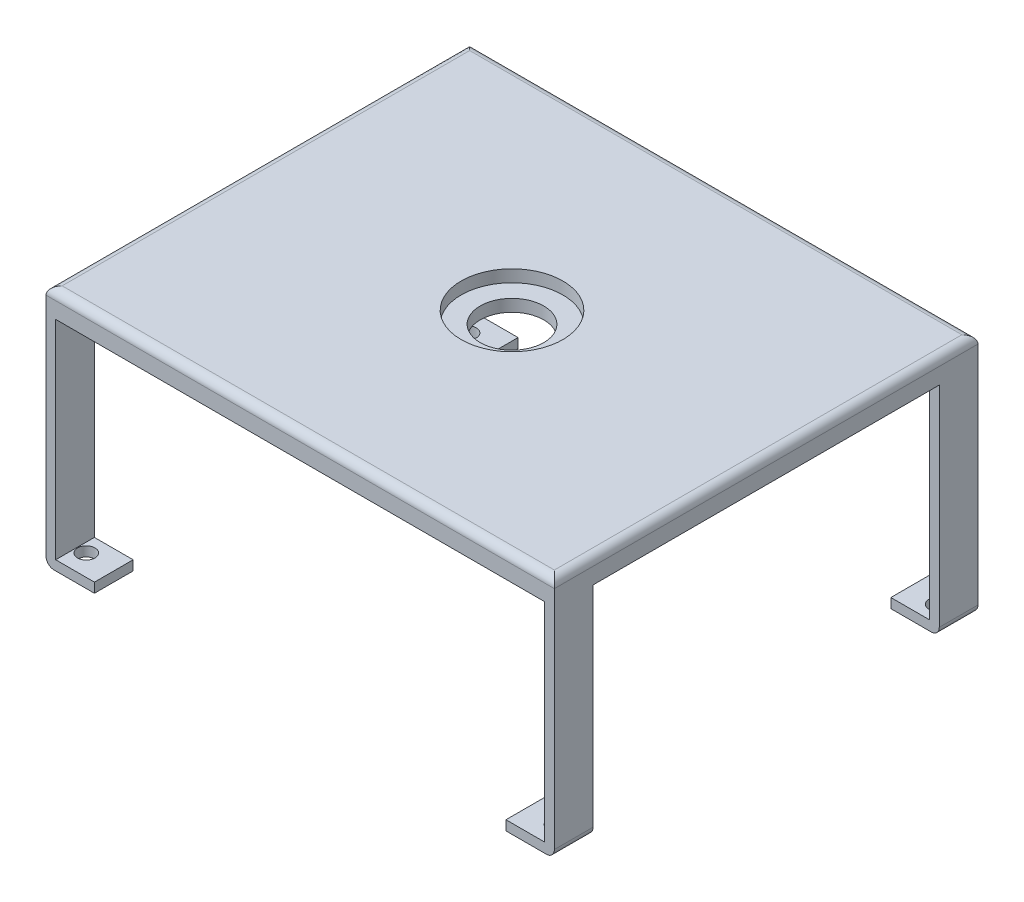
from build123d import *

# Parameters (mm, degrees)
BOSS_EXTRU_1_DEPTH      = 133.35
ESQUISSE3_W             = 108.966
ESQUISSE3_H             = 68.58
ENL_V_MAT_EXTRU_1_DEPTH = 222.799600766
CONG_1_R                = 2.54
CONG_2_R                = 2.54
ESQUISSE6_R             = 10
ENL_V_MAT_EXTRU_4_DEPTH = 174.176969023
ESQUISSE9_R             = 16
ENL_V_MAT_EXTRU_5_DEPTH = 3.81
SKETCH1_R               = 2.75
CUT_EXTRUDE1_DEPTH      = 3.048


with BuildPart() as part:
    # Esquisse2 → Boss.-Extru.1 (new body)
    with BuildSketch(Plane.XY):
        Polygon((-64.77, 0), (-80.01, 0), (-80.01, 76.2), (80.01, 76.2), (80.01, 0), (64.77, 0), (64.77, 3.048), (76.962, 3.048), (76.962, 68.58), (-76.962, 68.58), (-76.962, 3.048), (-64.77, 3.048), align=None)
    extrude(amount=BOSS_EXTRU_1_DEPTH)

    # Esquisse3 → Enlèv. mat.-Extru.1 (cut, through all)
    with BuildSketch(Plane.ZY.offset(80.01)):
        with Locations((66.675, 34.29)):
            Rectangle(ESQUISSE3_W, ESQUISSE3_H)
    extrude(amount=-ENL_V_MAT_EXTRU_1_DEPTH, mode=Mode.SUBTRACT)

    # Congé1
    cong_1_edges = [part.edges().sort_by_distance(p)[0] for p in [
        (-80.01, 0, 127.254),
        (80.01, 0, 127.254),
        (-80.01, 0, 6.096),
        (80.01, 0, 6.096),
    ]]
    fillet(cong_1_edges, radius=CONG_1_R)

    # Congé2
    cong_2_edges = [part.edges().sort_by_distance(p)[0] for p in [
        (0, 76.2, 0),
        (-80.01, 76.2, 66.675),
        (80.01, 76.2, 66.675),
        (0, 76.2, 133.35),
    ]]
    fillet(cong_2_edges, radius=CONG_2_R)

    # Esquisse6 → Enlèv. mat.-Extru.4 (cut, through all)
    with BuildSketch(Plane(origin=(0, 76.2, 0), x_dir=(1, 0, 0), z_dir=(0, 1, 0))):
        with Locations(Location((0, -66.675, 0), (0, 0, 270))):
            Circle(ESQUISSE6_R)
    extrude(amount=-ENL_V_MAT_EXTRU_4_DEPTH, mode=Mode.SUBTRACT)

    # Esquisse9 → Enlèv. mat.-Extru.5 (cut)
    with BuildSketch(Plane(origin=(0, 76.2, 0), x_dir=(1, 0, 0), z_dir=(0, 1, 0))):
        with Locations(Location((0, -66.675, 0), (0, 0, 270))):
            Circle(ESQUISSE9_R)
    extrude(amount=-ENL_V_MAT_EXTRU_5_DEPTH, mode=Mode.SUBTRACT)

    # Sketch1 → Cut-Extrude1 (cut)
    with BuildSketch(Plane.XZ):
        with Locations((74, 126.675)):
            Circle(SKETCH1_R)
        with Locations((74, 6.675)):
            Circle(SKETCH1_R)
        with Locations((-74, 6.675)):
            Circle(SKETCH1_R)
        with Locations((-74, 126.675)):
            Circle(SKETCH1_R)
    extrude(amount=-CUT_EXTRUDE1_DEPTH, mode=Mode.SUBTRACT)


solid = part.part
